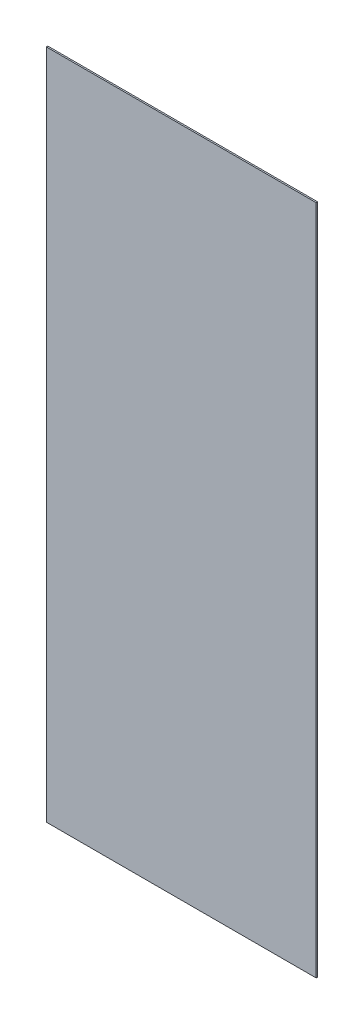
from build123d import *

# Parameters (mm, degrees)
SKETCH_1_W      = 506.3
SKETCH_1_H      = 1259.5
EXTRUDE_1_DEPTH = 2.75


with BuildPart() as part:
    # 草圖1 → 填料-伸長1 (new body)
    with BuildSketch(Plane.XY):
        Rectangle(SKETCH_1_W, SKETCH_1_H)
    extrude(amount=EXTRUDE_1_DEPTH)


solid = part.part
